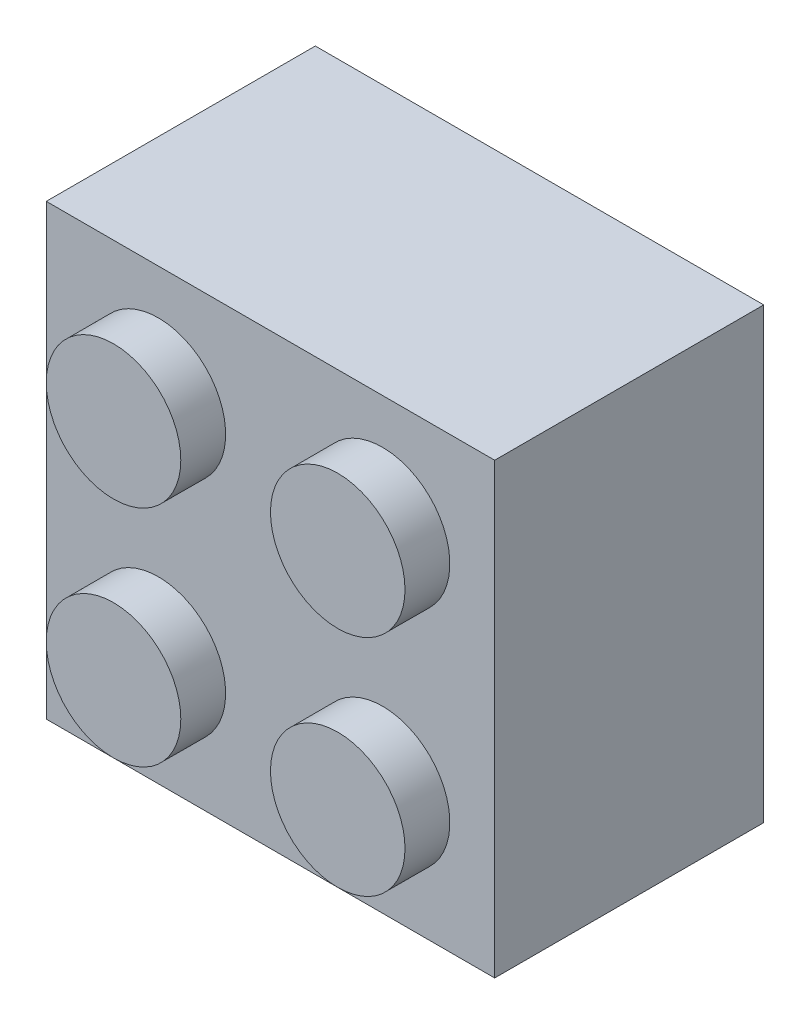
from build123d import *

# Parameters (mm, degrees)
SKETCH1_W            = 15.875
SKETCH1_H            = 15.875
BOSS_EXTRUDE1_DEPTH  = 9.525
SKETCH2_R            = 2.38125
BOSS_EXTRUDE2_DEPTH  = 1.5875
LPATTERN1_COUNT      = 2
LPATTERN1_PITCH      = 7.9375
LPATTERN1_COUNT_DIR2 = 2
LPATTERN1_PITCH_DIR2 = 7.9375
SHELL1_T             = -1.5875
SKETCH3_R            = 3.175
SKETCH3_R_2          = 2.38125
BOSS_EXTRUDE9_DEPTH  = 7.9375


with BuildPart() as part:
    # Sketch1 → Boss-Extrude1 (new body)
    with BuildSketch(Plane.XY):
        with Locations((7.9375, 7.9375)):
            Rectangle(SKETCH1_W, SKETCH1_H)
    extrude(amount=BOSS_EXTRUDE1_DEPTH)

    # Sketch2 → Boss-Extrude2 (add)
    with BuildSketch(Plane.XY.offset(9.525)):
        with Locations(Location((3.96875, 11.90625, 0), (0, 0, 180))):
            Circle(SKETCH2_R)
    boss_extrude2 = extrude(amount=BOSS_EXTRUDE2_DEPTH)

    # LPattern1: Boss-Extrude2 2 × 2
    with Locations(*[(j * LPATTERN1_PITCH_DIR2, -i * LPATTERN1_PITCH, 0) for i in range(LPATTERN1_COUNT) for j in range(LPATTERN1_COUNT_DIR2) if (i, j) != (0, 0)]):
        add(boss_extrude2)

    # Shell1
    shell1_openings = [part.faces().sort_by_distance(p)[0] for p in [
        (7.9375, 7.9375, 0),
    ]]
    offset(amount=SHELL1_T, openings=shell1_openings, kind=Kind.INTERSECTION)

    # Sketch3 → Boss-Extrude9 (add)
    with BuildSketch(Plane(origin=(0, 0, 7.9375), x_dir=(-1, 0, 0), z_dir=(0, 0, -1))):
        with Locations((-7.9375, 7.9375)):
            Circle(SKETCH3_R)
        with Locations((-7.9375, 7.9375)):
            Circle(SKETCH3_R_2, mode=Mode.SUBTRACT)
    extrude(amount=BOSS_EXTRUDE9_DEPTH)


solid = part.part
